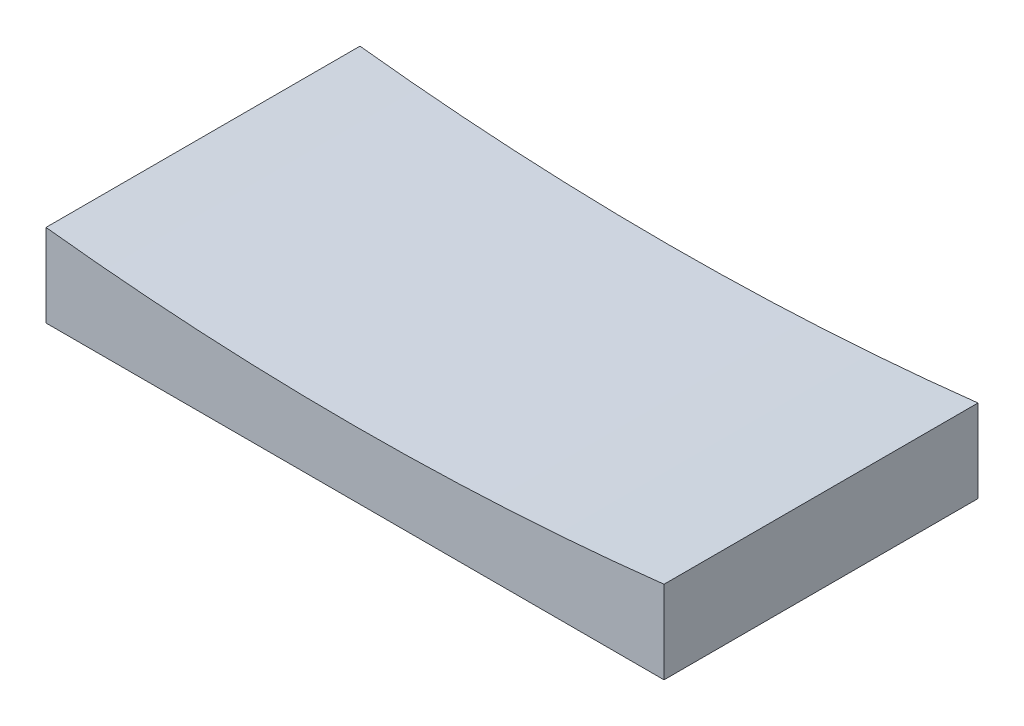
from build123d import *

# Parameters (mm, degrees)
SKETCH_1_W          = 50
SKETCH_1_H          = 25.4
EXTRUDE_1_DEPTH     = 6.7
CUT_EXTRUDE_1_REACH = 38.264


with BuildPart() as part:
    # 草图1 → 凸台-拉伸1 (new body)
    with BuildSketch(Plane(origin=(0, 0, 0), x_dir=(1, 0, 0), z_dir=(0, 1, 0))):
        Rectangle(SKETCH_1_W, SKETCH_1_H)
    extrude(amount=EXTRUDE_1_DEPTH)

    # 草图2 → 切除-拉伸1 (cut, up to next)
    with BuildSketch(Plane.XY.offset(12.7), mode=Mode.PRIVATE) as cut_extrude_1_sk1:
        with BuildLine():
            Line((25, 6.7), (-25, 6.7))
            ThreePointArc((-25, 6.7), (0, 5.274929944), (25, 6.7))
        make_face()
    cut_extrude_1_tool1 = extrude(cut_extrude_1_sk1.sketch, amount=-CUT_EXTRUDE_1_REACH, mode=Mode.PRIVATE) & part.part
    add(cut_extrude_1_tool1.solids().sort_by_distance((0, 6.129813, 12.7))[0], mode=Mode.SUBTRACT)


solid = part.part
